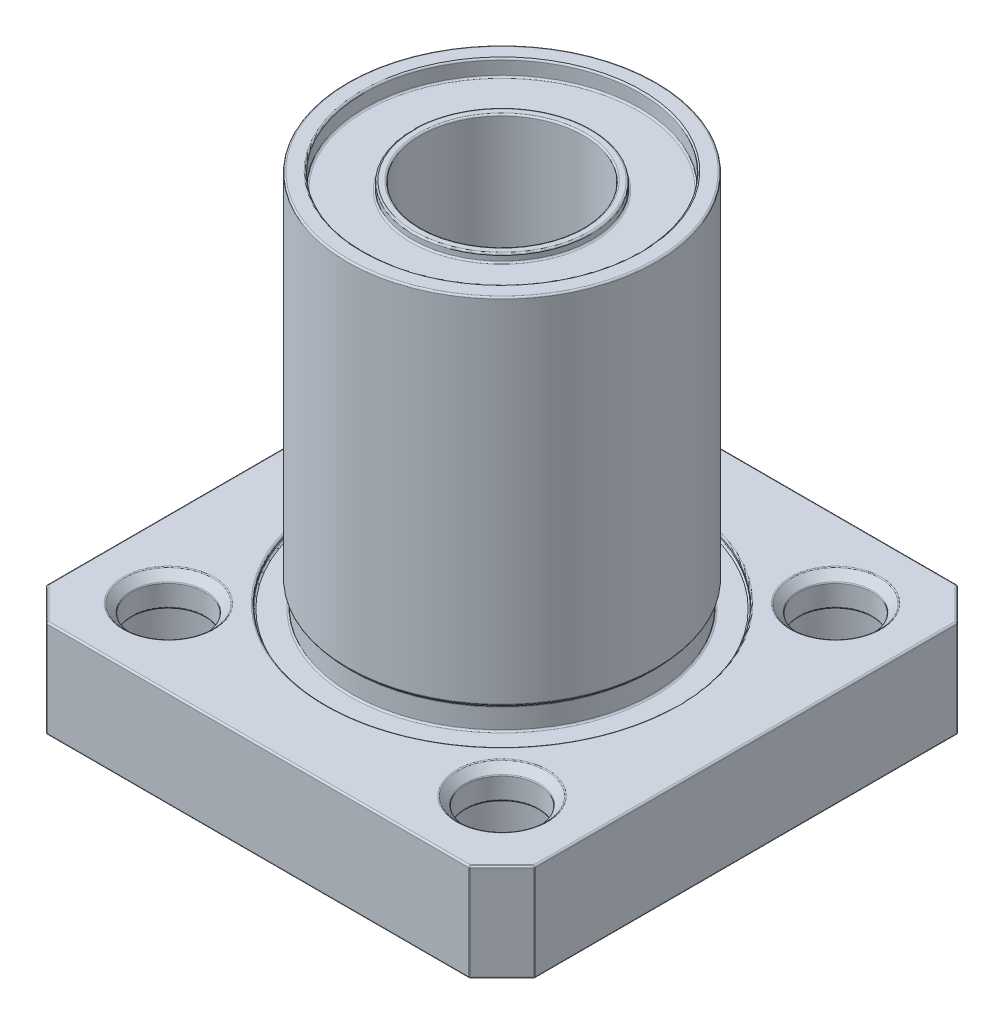
from build123d import *

# Parameters (mm, degrees)
SKETCH1_W           = 30
SKETCH1_H           = 30
BOSS_EXTRUDE1_DEPTH = 6
SKETCH2_R           = 9.5
BOSS_EXTRUDE2_DEPTH = 23
CUT_EXTRUDE3_REACH  = 33.289
SKETCH3_R           = 2.25
CHAMFER2_SIZE       = 2
SKETCH6_R           = 8.5
CUT_EXTRUDE4_DEPTH  = 36.930488446
CUT_EXTRUDE6_START  = -0.3
SKETCH7_R           = 10.8
SKETCH7_R_2         = 9.5
CUT_EXTRUDE6_DEPTH  = 0.3
SKETCH9_R           = 8.5
SKETCH9_R_2         = 5
BOSS_EXTRUDE3_DEPTH = 27
BOSS_EXTRUDE4_START = 0.5
SKETCH10_R          = 5.5
SKETCH10_R_2        = 5
BOSS_EXTRUDE4_DEPTH = 0.5
CHAMFER3_SIZE       = 0.5
SKETCH12_R          = 3.75
CUT_EXTRUDE7_DEPTH  = 4.1
FILLET2_R           = 0.1
CHAMFER4_SIZE       = 0.5


with BuildPart() as part:
    # Sketch1 → Boss-Extrude1 (new body)
    with BuildSketch(Plane(origin=(0, 0, 0), x_dir=(1, 0, 0), z_dir=(0, 1, 0))):
        Rectangle(SKETCH1_W, SKETCH1_H)
    extrude(amount=BOSS_EXTRUDE1_DEPTH)

    # Sketch2 → Boss-Extrude2 (add)
    with BuildSketch(Plane(origin=(0, 6, 0), x_dir=(1, 0, 0), z_dir=(0, 1, 0))):
        with Locations(Location((0, 0, 0), (0, 0, 270))):
            Circle(SKETCH2_R)
    extrude(amount=BOSS_EXTRUDE2_DEPTH)

    # Sketch3 → Cut-Extrude3 (cut, up to next)
    with BuildSketch(Plane(origin=(0, 6, 0), x_dir=(1, 0, 0), z_dir=(0, 1, 0)), mode=Mode.PRIVATE) as cut_extrude3_sk1:
        with Locations(Location((-10.253048327, 10.253048327, 0), (0, 0, 270))):
            Circle(SKETCH3_R)
    cut_extrude3_tool1 = extrude(cut_extrude3_sk1.sketch, amount=-CUT_EXTRUDE3_REACH, mode=Mode.PRIVATE) & part.part
    # Sketch3 → Cut-Extrude3 (cut, up to next)
    with BuildSketch(Plane(origin=(0, 6, 0), x_dir=(1, 0, 0), z_dir=(0, 1, 0)), mode=Mode.PRIVATE) as cut_extrude3_sk2:
        with Locations(Location((10.253048327, 10.253048327, 0), (0, 0, 270))):
            Circle(SKETCH3_R)
    cut_extrude3_tool2 = extrude(cut_extrude3_sk2.sketch, amount=-CUT_EXTRUDE3_REACH, mode=Mode.PRIVATE) & part.part
    # Sketch3 → Cut-Extrude3 (cut, up to next)
    with BuildSketch(Plane(origin=(0, 6, 0), x_dir=(1, 0, 0), z_dir=(0, 1, 0)), mode=Mode.PRIVATE) as cut_extrude3_sk3:
        with Locations(Location((10.253048327, -10.253048327, 0), (0, 0, 270))):
            Circle(SKETCH3_R)
    cut_extrude3_tool3 = extrude(cut_extrude3_sk3.sketch, amount=-CUT_EXTRUDE3_REACH, mode=Mode.PRIVATE) & part.part
    # Sketch3 → Cut-Extrude3 (cut, up to next)
    with BuildSketch(Plane(origin=(0, 6, 0), x_dir=(1, 0, 0), z_dir=(0, 1, 0)), mode=Mode.PRIVATE) as cut_extrude3_sk4:
        with Locations(Location((-10.253048327, -10.253048327, 0), (0, 0, 270))):
            Circle(SKETCH3_R)
    cut_extrude3_tool4 = extrude(cut_extrude3_sk4.sketch, amount=-CUT_EXTRUDE3_REACH, mode=Mode.PRIVATE) & part.part
    add(cut_extrude3_tool1.solids().sort_by_distance((-10.253048, 6, -10.253048))[0], mode=Mode.SUBTRACT)
    add(cut_extrude3_tool2.solids().sort_by_distance((10.253048, 6, -10.253048))[0], mode=Mode.SUBTRACT)
    add(cut_extrude3_tool3.solids().sort_by_distance((10.253048, 6, 10.253048))[0], mode=Mode.SUBTRACT)
    add(cut_extrude3_tool4.solids().sort_by_distance((-10.253048, 6, 10.253048))[0], mode=Mode.SUBTRACT)

    # Chamfer2
    chamfer2_edges = [part.edges().sort_by_distance(p)[0] for p in [
        (15, 3, 15),
        (-15, 3, 15),
        (-15, 3, -15),
        (15, 3, -15),
    ]]
    chamfer(chamfer2_edges, length=CHAMFER2_SIZE)

    # Sketch6 → Cut-Extrude4 (cut, through all)
    with BuildSketch(Plane(origin=(0, 29, 0), x_dir=(1, 0, 0), z_dir=(0, 1, 0))):
        with Locations(Location((0, 0, 0), (0, 0, 270))):
            Circle(SKETCH6_R)
    extrude(amount=-CUT_EXTRUDE4_DEPTH, mode=Mode.SUBTRACT)

    # Sketch7 → Cut-Extrude6 (cut)
    with BuildSketch(Plane(origin=(0, 6, 0), x_dir=(1, 0, 0), z_dir=(0, 1, 0)).offset(CUT_EXTRUDE6_START)):
        with Locations(Location((0, 0, 0), (0, 0, 270))):
            Circle(SKETCH7_R)
        with Locations(Location((0, 0, 0), (0, 0, 270))):
            Circle(SKETCH7_R_2, mode=Mode.SUBTRACT)
    extrude(amount=CUT_EXTRUDE6_DEPTH, mode=Mode.SUBTRACT)

    # Sketch8 → Cut-Revolve1 (revolve, cut)
    with BuildSketch(Plane.XY, mode=Mode.PRIVATE) as cut_revolve1_sk:
        Polygon((-9.5, 7.3), (-9.5, 5.7), (-9.25, 5.7), (-9.25, 7.05), align=None)
    revolve(cut_revolve1_sk.sketch.rotate(Axis((0, 29, 0), (0, -1, 0)), 270), axis=Axis((0, 29, 0), (0, -1, 0)), mode=Mode.SUBTRACT)

    # Sketch9 → Boss-Extrude3 (add)
    with BuildSketch(Plane(origin=(0, 28, 0), x_dir=(1, 0, 0), z_dir=(0, 1, 0))):
        with Locations(Location((0, 0, 0), (0, 0, 270))):
            Circle(SKETCH9_R)
        with Locations(Location((0, 0, 0), (0, 0, 270))):
            Circle(SKETCH9_R_2, mode=Mode.SUBTRACT)
    extrude(amount=-BOSS_EXTRUDE3_DEPTH)

    # Sketch10 → Boss-Extrude4 (add)
    with BuildSketch(Plane(origin=(0, 28, 0), x_dir=(1, 0, 0), z_dir=(0, 1, 0)).offset(BOSS_EXTRUDE4_START)):
        with Locations(Location((0, 0, 0), (0, 0, 270))):
            Circle(SKETCH10_R)
        with Locations(Location((0, 0, 0), (0, 0, 270))):
            Circle(SKETCH10_R_2, mode=Mode.SUBTRACT)
    extrude(amount=-BOSS_EXTRUDE4_DEPTH)

    # Chamfer3
    chamfer3_edges = [part.edges().sort_by_distance(p)[0] for p in [
        (-10.253048327, 6, 8.003048327),
        (10.253048327, 6, 8.003048327),
        (10.253048327, 6, -12.503048327),
        (-10.253048327, 6, -12.503048327),
    ]]
    chamfer(chamfer3_edges, length=CHAMFER3_SIZE)

    # Sketch12 → Cut-Extrude7 (cut)
    with BuildSketch(Plane.XZ):
        with Locations(Location((-10.253048327, 10.253048327, 0), (0, 0, 270))):
            Circle(SKETCH12_R)
        with Locations(Location((10.253048327, 10.253048327, 0), (0, 0, 270))):
            Circle(SKETCH12_R)
        with Locations(Location((-10.253048327, -10.253048327, 0), (0, 0, 270))):
            Circle(SKETCH12_R)
        with Locations(Location((10.253048327, -10.253048327, 0), (0, 0, 270))):
            Circle(SKETCH12_R)
    extrude(amount=-CUT_EXTRUDE7_DEPTH, mode=Mode.SUBTRACT)

    # Fillet2
    fillet2_edges = [part.edges().sort_by_distance(p)[0] for p in [
        (10.253048327, 4.1, 8.003048327),
        (-10.253048327, 4.1, -12.503048327),
        (10.253048327, 4.1, -12.503048327),
        (-10.253048327, 4.1, 8.003048327),
        (0, 29, -9.5),
        (0, 0, -15),
        (0, 6, -15),
        (-13, 3, -15),
        (13, 3, -15),
        (15, 0, 0),
        (0, 0, 15),
        (-15, 0, 0),
        (-14, 0, -14),
        (-14, 0, 14),
        (14, 0, 14),
        (14, 0, -14),
        (15, 6, 0),
        (15, 3, 13),
        (15, 3, -13),
        (-15, 6, 0),
        (0, 6, 15),
        (-14, 6, -14),
        (-14, 6, 14),
        (14, 6, 14),
        (14, 6, -14),
        (-13, 3, 15),
        (13, 3, 15),
        (-15, 3, -13),
        (-15, 3, 13),
        (0, 0, -8.5),
        (0, 29, -8.5),
        (0, 5.7, -10.8),
        (0, 6, -10.8),
        (0, 7.3, -9.5),
        (0, 5.7, -9.25),
        (0, 7.05, -9.25),
        (0, 1, -8.5),
        (0, 28, -8.5),
        (0, 28.5, -5.5),
        (0, 28, -5.5),
        (0, 28.5, -5),
        (10.253048327, 5.5, 8.003048327),
        (-10.253048327, 6, -13.003048327),
        (-10.253048327, 6, 7.503048327),
        (10.253048327, 6, -13.003048327),
        (10.253048327, 6, 7.503048327),
        (10.253048327, 5.5, -12.503048327),
        (-10.253048327, 5.5, 8.003048327),
        (-10.253048327, 5.5, -12.503048327),
    ]]
    fillet(fillet2_edges, radius=FILLET2_R)

    # Chamfer4
    chamfer4_edges = [part.edges().sort_by_distance(p)[0] for p in [
        (10.253048327, 0, 14.003048327),
        (-10.253048327, 0, -6.503048327),
        (10.253048327, 0, -6.503048327),
        (-10.253048327, 0, 14.003048327),
    ]]
    chamfer(chamfer4_edges, length=CHAMFER4_SIZE)


solid = part.part
